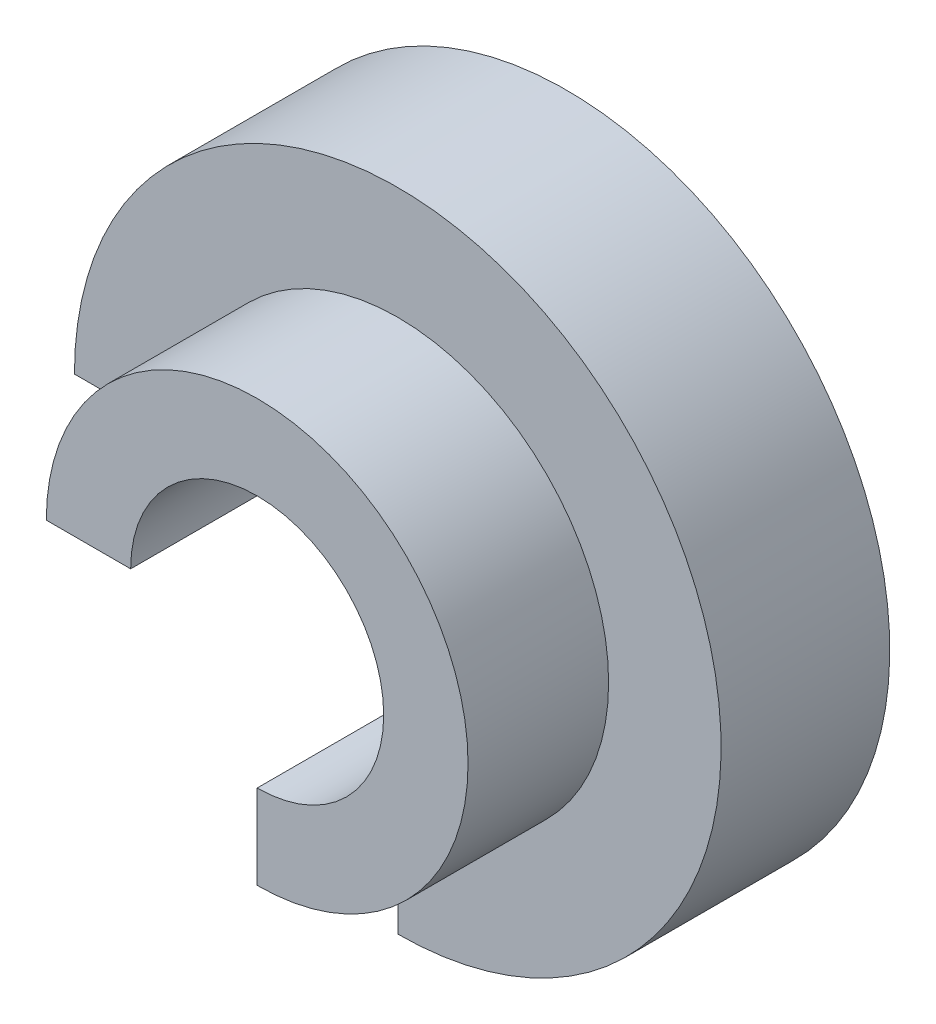
from build123d import *

# Parameters (mm, degrees)
REVOLVE1_ANGLE = 270


with BuildPart() as part:
    # Sketch1 → Revolve1 (revolve)
    with BuildSketch(Plane(origin=(0, 0, 0), x_dir=(1, 0, 0), z_dir=(0, 1, 0))):
        Polygon((-60, 150), (-110, 150), (-110, 110), (-170, 110), (-170, 70), (-230, 70), (-230, -50), (-150, -50), (-150, -150), (-90, -150), (-90, -30), (-180, -30), (-180, 40), (-130, 40), (-130, 80), (-90, 80), (-90, 110), (-60, 110), align=None)
    revolve(axis=Axis((0, 0, 150), (0, 0, -1)), revolution_arc=REVOLVE1_ANGLE)


solid = part.part
